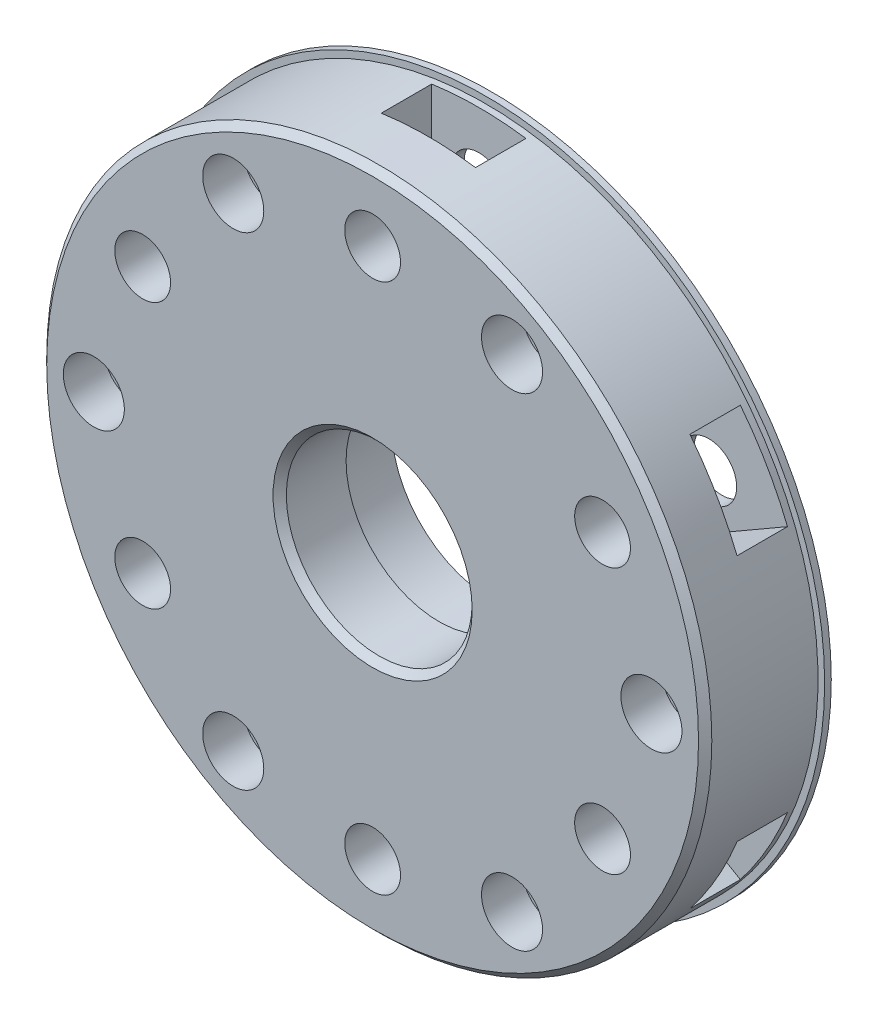
from build123d import *

# Parameters (mm, degrees)
OUTPUT_MASTER_SKETCH_R  = 25.05
BOSS_EXTRUDE1_DEPTH     = 9
SKETCH4_R               = 3.05
CUT_EXTRUDE1_DEPTH      = 4
SKETCH5_R               = 25.55
SKETCH5_R_2             = 25.05
BOSS_EXTRUDE2_DEPTH     = 0.5
SKETCH6_R               = 1.55
CUT_EXTRUDE2_DEPTH      = 38.237145433
SKETCH7_R               = 2.3
CUT_EXTRUDE3_DEPTH      = 3.1
CHAMFER1_SIZE           = 0.5
SKETCH8_R               = 7
CUT_EXTRUDE4_DEPTH      = 10
SKETCH9_R               = 7.575
CUT_EXTRUDE5_DEPTH      = 4
SKETCH10_R              = 2.1
M4_THRU_DEPTH           = 38.237145433
CHAMFER3_SIZE           = 0.5
M4_START                = -8
M4_HEXNUT_CUT_DEPTH     = 3.8
SKETCH12_W              = 7.1
SKETCH12_H              = 3.8
M4_HEXNUT_SLOT_DEPTH    = 55.767908461
M4_HEXNUT_PATTERN_COUNT = 6


with BuildPart() as part:
    # Output Master Sketch → Boss-Extrude1 (new body)
    with BuildSketch(Plane.XY):
        Circle(OUTPUT_MASTER_SKETCH_R)
    extrude(amount=BOSS_EXTRUDE1_DEPTH)

    # Sketch4 → Cut-Extrude1 (cut)
    with BuildSketch(Plane.XY):
        with Locations((21, 0)):
            Circle(SKETCH4_R)
        with Locations((10.5, -18.186533479)):
            Circle(SKETCH4_R)
        with Locations((-10.5, -18.186533479)):
            Circle(SKETCH4_R)
        with Locations((-21, 0)):
            Circle(SKETCH4_R)
        with Locations((-10.5, 18.186533479)):
            Circle(SKETCH4_R)
        with Locations((10.5, 18.186533479)):
            Circle(SKETCH4_R)
    extrude(amount=CUT_EXTRUDE1_DEPTH, mode=Mode.SUBTRACT)

    # Sketch5 → Boss-Extrude2 (add)
    with BuildSketch(Plane(origin=(0, 0, 0), x_dir=(-1, 0, 0), z_dir=(0, 0, -1))):
        Circle(SKETCH5_R)
        Circle(SKETCH5_R_2, mode=Mode.SUBTRACT)
    extrude(amount=-BOSS_EXTRUDE2_DEPTH)

    # Sketch6 → Cut-Extrude2 (cut, through all)
    with BuildSketch(Plane(origin=(0, 0, 0), x_dir=(-1, 0, 0), z_dir=(0, 0, -1))):
        with Locations((-21, 0)):
            Circle(SKETCH6_R)
        with Locations((-10.5, 18.186533479)):
            Circle(SKETCH6_R)
        with Locations((10.5, 18.186533479)):
            Circle(SKETCH6_R)
        with Locations((21, 0)):
            Circle(SKETCH6_R)
        with Locations((10.5, -18.186533479)):
            Circle(SKETCH6_R)
        with Locations((-10.5, -18.186533479)):
            Circle(SKETCH6_R)
    extrude(amount=-CUT_EXTRUDE2_DEPTH, mode=Mode.SUBTRACT)

    # Sketch7 → Cut-Extrude3 (cut)
    with BuildSketch(Plane.XY.offset(9)):
        with Locations((-21, 0)):
            Circle(SKETCH7_R)
        with Locations((-10.5, 18.186533479)):
            Circle(SKETCH7_R)
        with Locations((10.5, 18.186533479)):
            Circle(SKETCH7_R)
        with Locations((21, 0)):
            Circle(SKETCH7_R)
        with Locations((10.5, -18.186533479)):
            Circle(SKETCH7_R)
        with Locations((-10.5, -18.186533479)):
            Circle(SKETCH7_R)
    extrude(amount=-CUT_EXTRUDE3_DEPTH, mode=Mode.SUBTRACT)

    # Chamfer1
    chamfer1_edges = [part.edges().sort_by_distance(p)[0] for p in [
        (-25.05, 0, 9),
    ]]
    chamfer(chamfer1_edges, length=CHAMFER1_SIZE)

    # Sketch8 → Cut-Extrude4 (cut)
    with BuildSketch(Plane(origin=(0, 0, 0), x_dir=(-1, 0, 0), z_dir=(0, 0, -1))):
        Circle(SKETCH8_R)
    extrude(amount=-CUT_EXTRUDE4_DEPTH, mode=Mode.SUBTRACT)

    # Sketch9 → Cut-Extrude5 (cut)
    with BuildSketch(Plane(origin=(0, 0, 0), x_dir=(-1, 0, 0), z_dir=(0, 0, -1))):
        Circle(SKETCH9_R)
    extrude(amount=-CUT_EXTRUDE5_DEPTH, mode=Mode.SUBTRACT)

    # Sketch10 → M4 Thru (cut, through all)
    with BuildSketch(Plane.XY.offset(9)):
        with Locations((0, 20)):
            Circle(SKETCH10_R)
        with Locations((17.320508076, 10)):
            Circle(SKETCH10_R)
        with Locations((17.320508076, -10)):
            Circle(SKETCH10_R)
        with Locations((0, -20)):
            Circle(SKETCH10_R)
        with Locations((-17.320508076, -10)):
            Circle(SKETCH10_R)
        with Locations((-17.320508076, 10)):
            Circle(SKETCH10_R)
    extrude(amount=-M4_THRU_DEPTH, mode=Mode.SUBTRACT)

    # Chamfer3
    chamfer3_edges = [part.edges().sort_by_distance(p)[0] for p in [
        (7, 0, 9),
    ]]
    chamfer(chamfer3_edges, length=CHAMFER3_SIZE)

    # Sketch11 → M4 Hexnut Cut (cut)
    with BuildSketch(Plane.XY.offset(9).offset(M4_START)):
        Polygon((0, 24.099186911), (-3.55, 22.049593456), (-3.55, 17.950406544), (0, 15.900813089), (3.55, 17.950406544), (3.55, 22.049593456), align=None)
    m4_hexnut_cut = extrude(amount=M4_HEXNUT_CUT_DEPTH, mode=Mode.SUBTRACT)

    # Sketch12 → M4 Hexnut Slot (cut, through all)
    with BuildSketch(Plane(origin=(0, 22.049593456, 0), x_dir=(1, 0, 0), z_dir=(0, 1, 0))):
        with Locations((0, -2.9)):
            Rectangle(SKETCH12_W, SKETCH12_H)
    m4_hexnut_slot = extrude(amount=M4_HEXNUT_SLOT_DEPTH, mode=Mode.SUBTRACT)

    # M4 Hexnut Pattern: M4 Hexnut Cut, M4 Hexnut Slot ×6 about axis
    m4_hexnut_pattern_axis = Axis((0, 0, 0), (0, 0, 1))
    add([m4_hexnut_cut.rotate(m4_hexnut_pattern_axis, i * 360 / M4_HEXNUT_PATTERN_COUNT) for i in range(1, M4_HEXNUT_PATTERN_COUNT)], mode=Mode.SUBTRACT)
    add([m4_hexnut_slot.rotate(m4_hexnut_pattern_axis, i * 360 / M4_HEXNUT_PATTERN_COUNT) for i in range(1, M4_HEXNUT_PATTERN_COUNT)], mode=Mode.SUBTRACT)


solid = part.part
